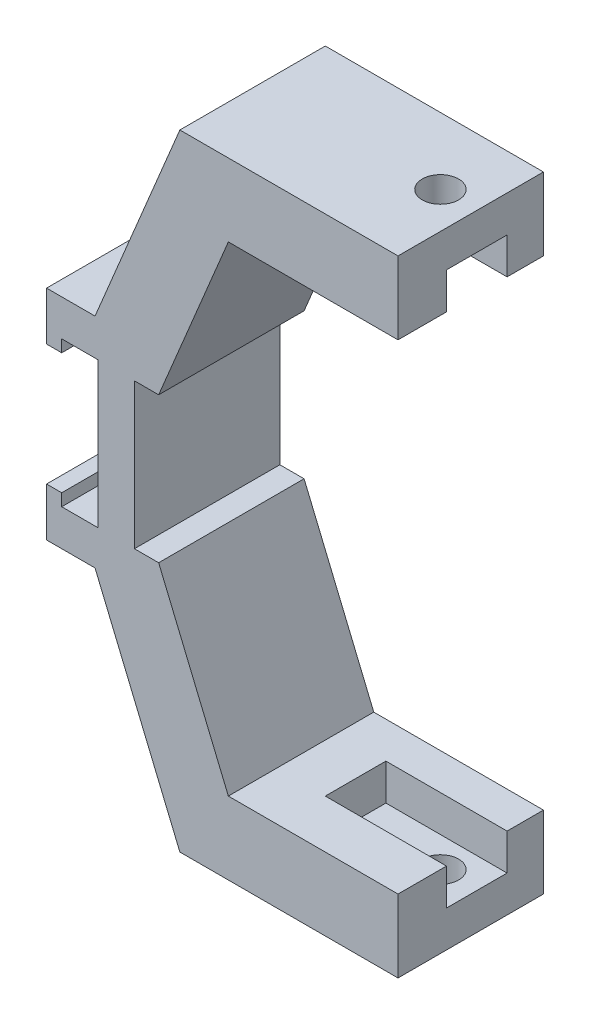
from build123d import *

# Parameters (mm, degrees)
BOSS_EXTRUDE1_DEPTH = 12
SKETCH2_W           = 5
SKETCH2_H           = 3
CUT_EXTRUDE1_DEPTH  = 10
CUT_EXTRUDE2_REACH  = 36.801
SKETCH3_R           = 1.5


with BuildPart() as part:
    # Sketch1 → Boss-Extrude1 (new body)
    with BuildSketch(Plane.XY):
        Polygon((-9.035894855, 9.330266172), (-16.035894855, -7.469733828), (-20.035894855, -7.469733828), (-20.035894855, -11.469733828), (-18.785894855, -11.469733828), (-18.785894855, -10.469733828), (-15.785894855, -10.469733828), (-15.785894855, -16.469733828), (-12.785894855, -16.469733828), (-12.785894855, -10.469733828), (-10.785894855, -10.469733828), (-5.035894855, 3.330266172), (8.964105145, 3.330266172), (8.964105145, 9.330266172), align=None)
    boss_extrude1 = extrude(amount=BOSS_EXTRUDE1_DEPTH)

    # Sketch2 → Cut-Extrude1 (cut)
    with BuildSketch(Plane(origin=(8.964105145, 0, 0), x_dir=(0, 0, -1), z_dir=(1, 0, 0))):
        with Locations((-5.5, 4.830266172)):
            Rectangle(SKETCH2_W, SKETCH2_H)
    cut_extrude1 = extrude(amount=-CUT_EXTRUDE1_DEPTH, mode=Mode.SUBTRACT)

    # Sketch3 → Cut-Extrude2 (cut, up to next)
    with BuildSketch(Plane(origin=(0, 9.330266172, 0), x_dir=(1, 0, 0), z_dir=(0, 1, 0)), mode=Mode.PRIVATE) as cut_extrude2_sk1:
        with Locations(Location((5.964105145, -5.5, 0), (0, 0, 180))):
            Circle(SKETCH3_R)
    cut_extrude2_tool1 = extrude(cut_extrude2_sk1.sketch, amount=-CUT_EXTRUDE2_REACH, mode=Mode.PRIVATE) & part.part
    cut_extrude2 = cut_extrude2_tool1.solids().sort_by_distance((5.964105, 9.330266, 5.5))[0]
    add(cut_extrude2, mode=Mode.SUBTRACT)

    # Mirror1: Boss-Extrude1, Cut-Extrude1, Cut-Extrude2 across plane
    add(boss_extrude1.mirror(Plane(origin=(-15.785894855, -16.469733828, 12), x_dir=(0, 0, 1), z_dir=(0, 1, 0))))
    add(cut_extrude1.mirror(Plane(origin=(-15.785894855, -16.469733828, 12), x_dir=(0, 0, 1), z_dir=(0, 1, 0))), mode=Mode.SUBTRACT)
    add(cut_extrude2.mirror(Plane(origin=(-15.785894855, -16.469733828, 12), x_dir=(0, 0, 1), z_dir=(0, 1, 0))), mode=Mode.SUBTRACT)


solid = part.part
